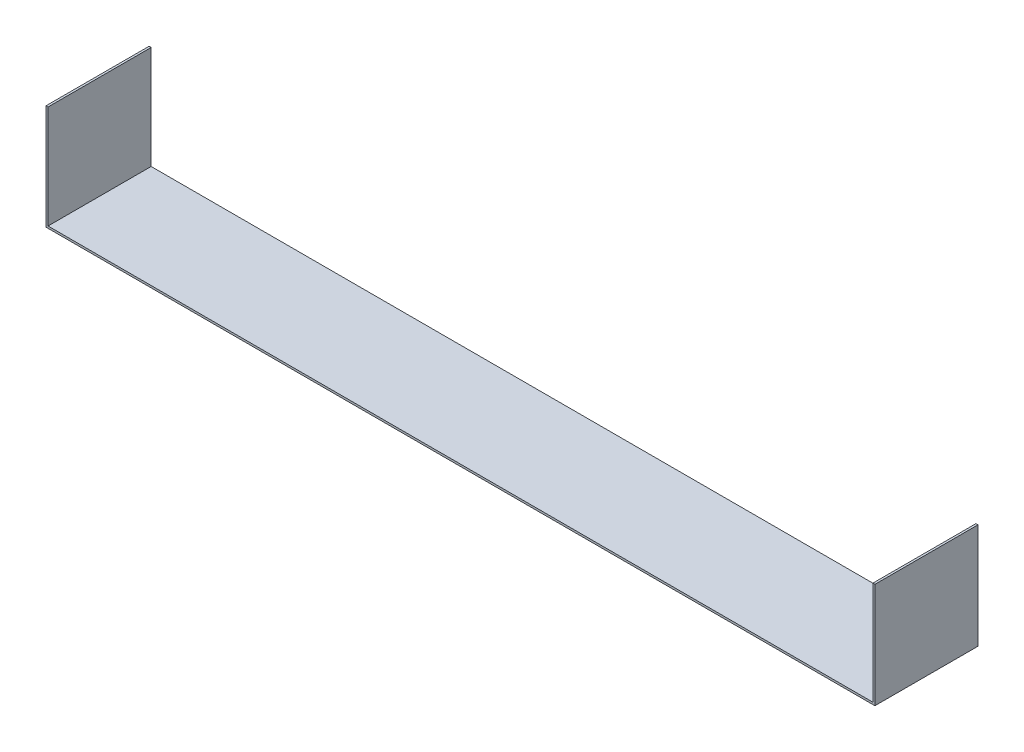
from build123d import *

# Parameters (mm, degrees)
BOSS_EXTRUDE1_DEPTH = 10000


with BuildPart() as part:
    # Sketch2 → Boss-Extrude1 (new body)
    with BuildSketch(Plane.XY):
        Polygon((0, 0), (0, -10000), (80000, -10000), (80000, 0), (80200, 0), (80200, -10200), (-200, -10200), (-200, 0), align=None)
    extrude(amount=-BOSS_EXTRUDE1_DEPTH)


solid = part.part
